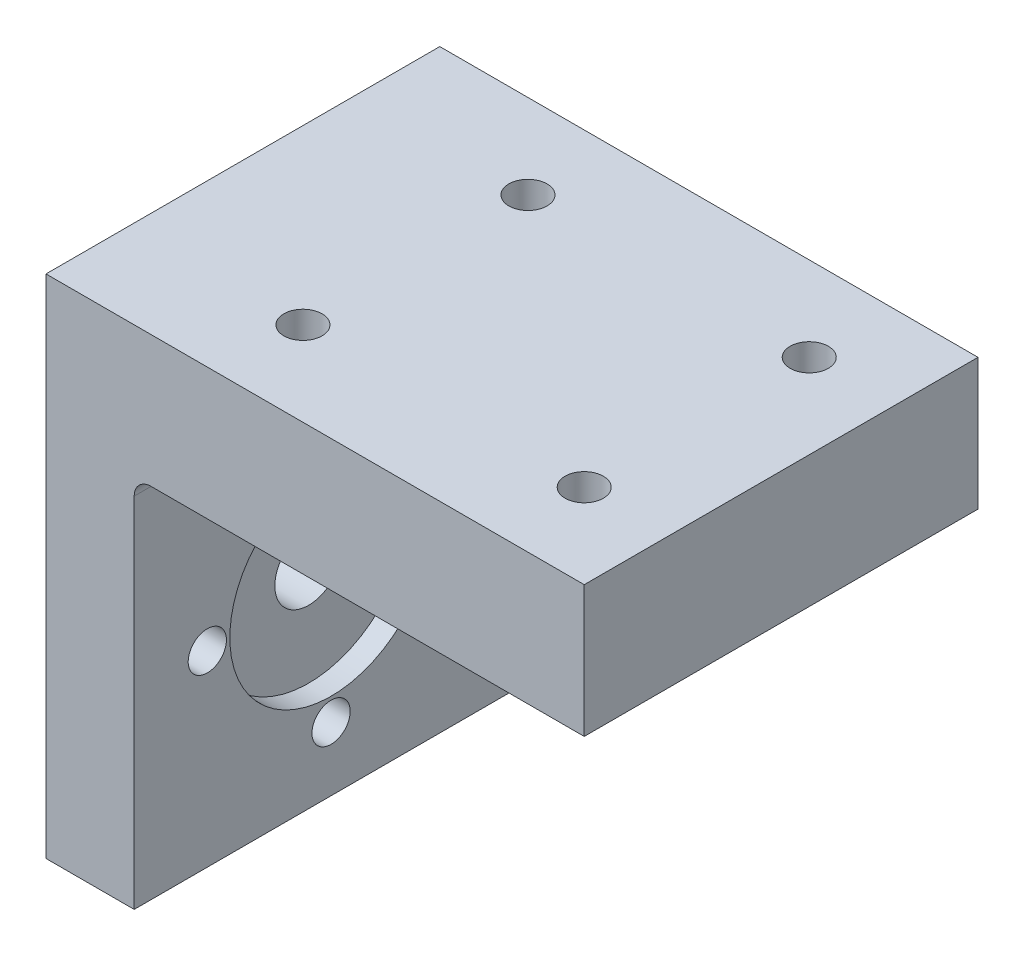
from build123d import *

# Parameters (mm, degrees)
SKETCH3_W           = 45
SKETCH3_H           = 35
BOSS_EXTRUDE1_DEPTH = 7.838444594
SKETCH10_W          = 11.6848633
SKETCH10_H          = 35
BOSS_EXTRUDE3_DEPTH = 40
SKETCH12_R          = 3
SKETCH12_R_2        = 1.7
CUT_EXTRUDE5_DEPTH  = 50.117206761
SKETCH13_R          = 9
CUT_EXTRUDE6_DEPTH  = 2
SKETCH14_R          = 1.7
CUT_EXTRUDE7_DEPTH  = 55.91947135
FILLET2_R           = 1.5


with BuildPart() as part:
    # Sketch3 → Boss-Extrude1 (new body)
    with BuildSketch(Plane.YZ):
        Rectangle(SKETCH3_W, SKETCH3_H)
    extrude(amount=-BOSS_EXTRUDE1_DEPTH)

    # Sketch10 → Boss-Extrude3 (add)
    with BuildSketch(Plane.YZ):
        with Locations((16.65756835, 0)):
            Rectangle(SKETCH10_W, SKETCH10_H)
    extrude(amount=BOSS_EXTRUDE3_DEPTH)

    # Sketch12 → Cut-Extrude5 (cut, through all)
    with BuildSketch(Plane.YZ):
        with Locations(Location((-5.84243165, 0, 0), (0, 0, 270))):
            Circle(SKETCH12_R)
        with Locations(Location((-5.84243165, 11, 0), (0, 0, 270))):
            Circle(SKETCH12_R_2)
        with Locations(Location((-16.84243165, 0, 0), (0, 0, 270))):
            Circle(SKETCH12_R_2)
        with Locations(Location((-5.84243165, -11, 0), (0, 0, 270))):
            Circle(SKETCH12_R_2)
        with Locations(Location((5.15756835, 0, 0), (0, 0, 270))):
            Circle(SKETCH12_R_2)
    extrude(amount=-CUT_EXTRUDE5_DEPTH, mode=Mode.SUBTRACT)

    # Sketch13 → Cut-Extrude6 (cut)
    with BuildSketch(Plane.YZ):
        with Locations(Location((-5.84243165, 0, 0), (0, 0, 270))):
            Circle(SKETCH13_R)
    extrude(amount=-CUT_EXTRUDE6_DEPTH, mode=Mode.SUBTRACT)

    # Sketch14 → Cut-Extrude7 (cut, through all)
    with BuildSketch(Plane.XZ.offset(-10.8151367)):
        with Locations(Location((7.5, 10, 0), (0, 0, 270))):
            Circle(SKETCH14_R)
        with Locations(Location((32.5, 10, 0), (0, 0, 270))):
            Circle(SKETCH14_R)
        with Locations(Location((7.5, -10, 0), (0, 0, 270))):
            Circle(SKETCH14_R)
        with Locations(Location((32.5, -10, 0), (0, 0, 270))):
            Circle(SKETCH14_R)
    extrude(amount=-CUT_EXTRUDE7_DEPTH, mode=Mode.SUBTRACT)

    # Fillet2
    fillet2_edges = [part.edges().sort_by_distance(p)[0] for p in [
        (0, 10.8151367, 0),
    ]]
    fillet(fillet2_edges, radius=FILLET2_R)


solid = part.part
